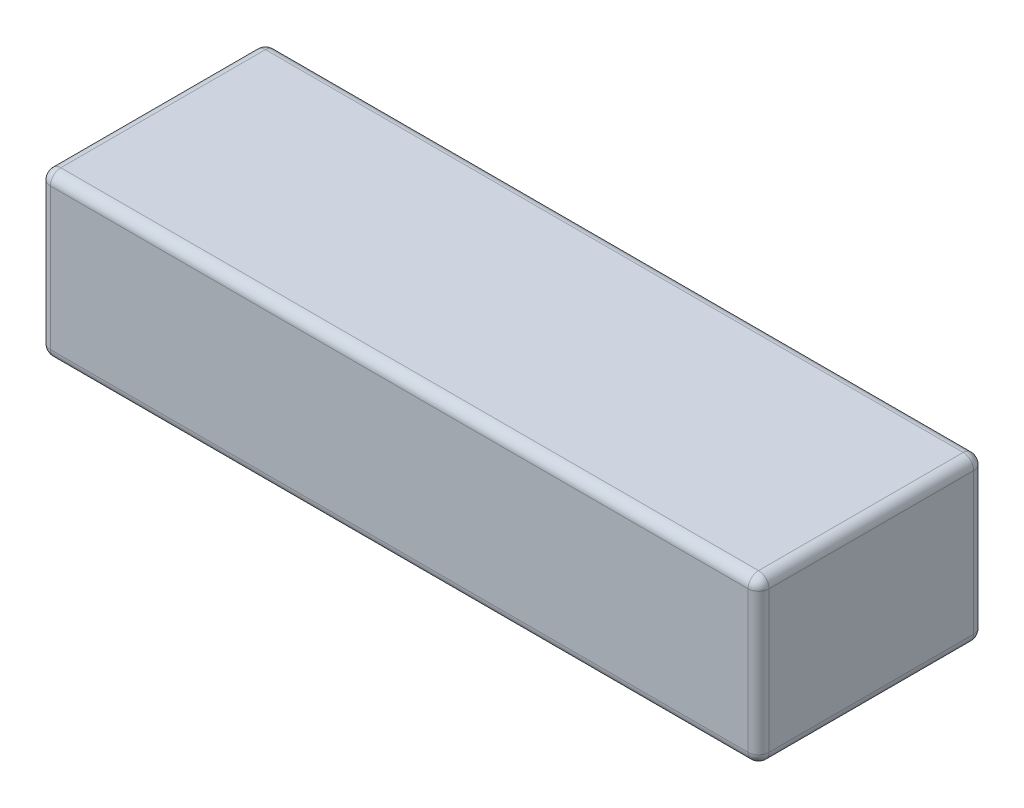
from build123d import *

# Parameters (mm, degrees)
SKETCH1_W           = 137
SKETCH1_H           = 43
BOSS_EXTRUDE1_DEPTH = 31
FILLET1_R           = 2


with BuildPart() as part:
    # Sketch1 → Boss-Extrude1 (new body)
    with BuildSketch(Plane(origin=(0, 0, 0), x_dir=(1, 0, 0), z_dir=(0, 1, 0))):
        with Locations((68.5, 21.5)):
            Rectangle(SKETCH1_W, SKETCH1_H)
    extrude(amount=BOSS_EXTRUDE1_DEPTH)

    # Fillet1
    fillet1_edges = [part.edges().sort_by_distance(p)[0] for p in [
        (137, 31, -21.5),
        (68.5, 31, -43),
        (0, 31, -21.5),
        (68.5, 0, -43),
        (137, 0, -21.5),
        (68.5, 0, 0),
        (0, 0, -21.5),
        (0, 15.5, -43),
        (137, 15.5, -43),
        (137, 15.5, 0),
        (0, 15.5, 0),
        (68.5, 31, 0),
    ]]
    fillet(fillet1_edges, radius=FILLET1_R)


solid = part.part
